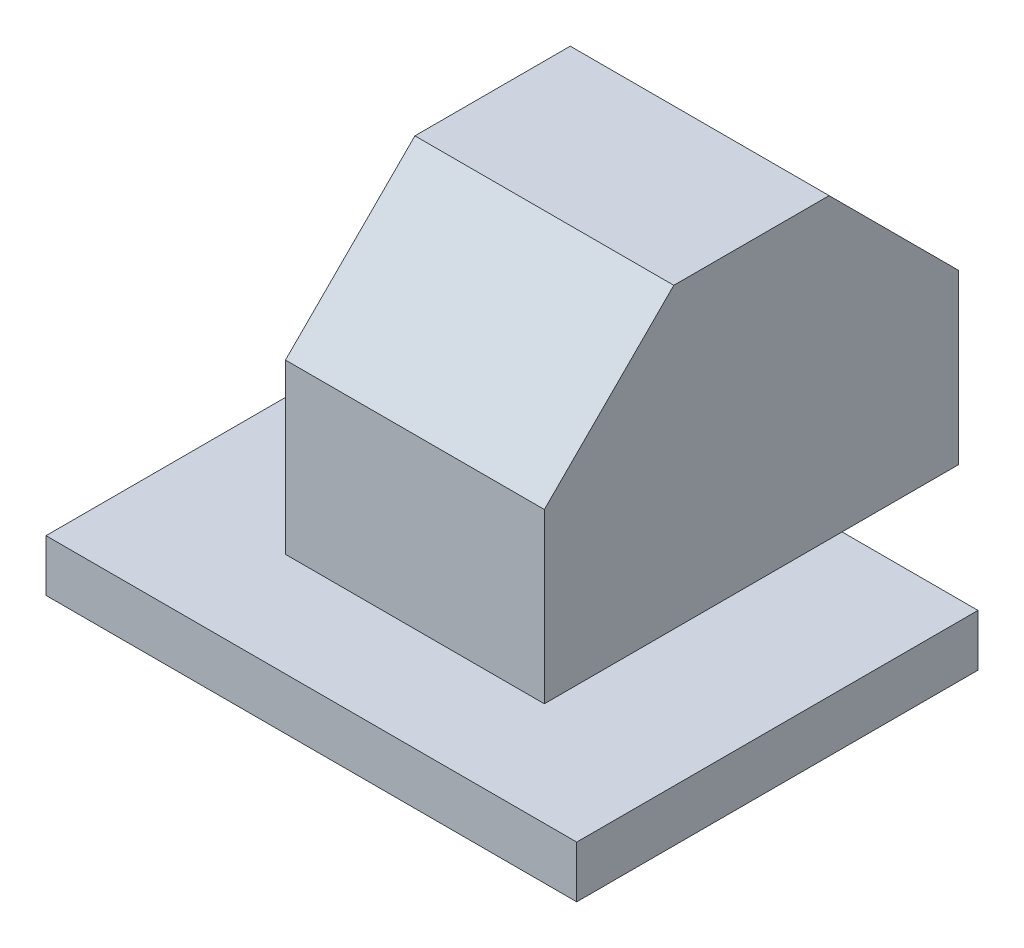
from build123d import *

# Parameters (mm, degrees)
SKETCH1_W           = 20.5
SKETCH1_H           = 15.5
BOSS_EXTRUDE1_DEPTH = 2
SKETCH3_W           = 10
SKETCH3_H           = 16
BOSS_EXTRUDE3_DEPTH = 11.5
SKETCH4_R           = 1.43812907
BOSS_EXTRUDE5_DEPTH = 1.5
CHAMFER1_SIZE       = 5


with BuildPart() as part:
    # Sketch1 → Boss-Extrude1 (new body)
    with BuildSketch(Plane(origin=(0, 0, 0), x_dir=(1, 0, 0), z_dir=(0, 1, 0))):
        Rectangle(SKETCH1_W, SKETCH1_H)
    extrude(amount=BOSS_EXTRUDE1_DEPTH)

    # Sketch3 → Boss-Extrude3 (add)
    with BuildSketch(Plane(origin=(0, 2, 0), x_dir=(1, 0, 0), z_dir=(0, 1, 0))):
        with Locations((0, 4.25)):
            Rectangle(SKETCH3_W, SKETCH3_H)
    extrude(amount=BOSS_EXTRUDE3_DEPTH)

    # Sketch4 → Boss-Extrude5 (add)
    with BuildSketch(Plane(origin=(0, 2, 0), x_dir=(1, 0, 0), z_dir=(0, 1, 0))):
        with Locations(Location((-8.644410723, 4.981189745, 0), (0, 0, 90))):
            Circle(SKETCH4_R)
    extrude(amount=BOSS_EXTRUDE5_DEPTH)

    # Chamfer1
    chamfer1_edges = [part.edges().sort_by_distance(p)[0] for p in [
        (0, 13.5, 3.75),
        (0, 13.5, -12.25),
    ]]
    chamfer(chamfer1_edges, length=CHAMFER1_SIZE)


solid = part.part
